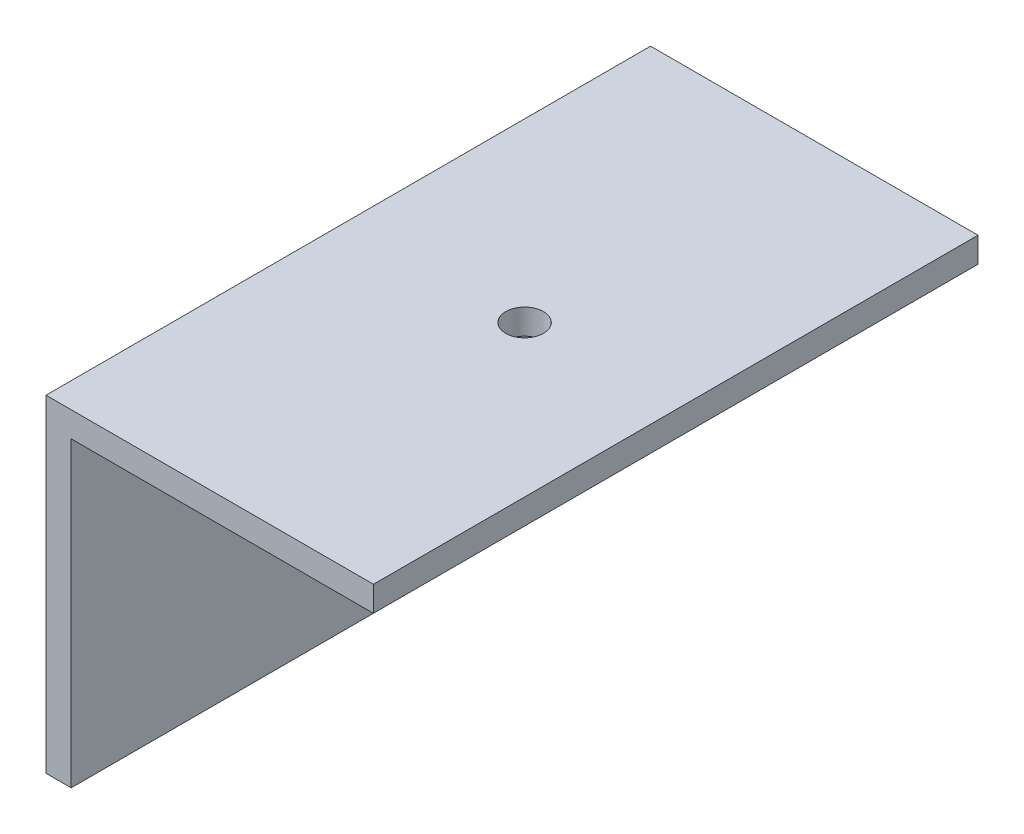
from build123d import *

# Parameters (mm, degrees)
BOSS_EXTRUDE1_DEPTH = 304.8
SKETCH2_R           = 9.525
CUT_EXTRUDE1_DEPTH  = 379.664508503


with BuildPart() as part:
    # Sketch1 → Boss-Extrude1 (new body)
    with BuildSketch(Plane.XY):
        Polygon((0, 0), (0, 165.1), (165.1, 165.1), (165.1, 152.4), (12.7, 152.4), (12.7, 0), align=None)
    extrude(amount=BOSS_EXTRUDE1_DEPTH)

    # Sketch2 → Cut-Extrude1 (cut, through all)
    with BuildSketch(Plane.XZ.offset(-152.4)):
        with Locations((88.9, 152.4)):
            Circle(SKETCH2_R)
    extrude(amount=-CUT_EXTRUDE1_DEPTH, mode=Mode.SUBTRACT)


solid = part.part
